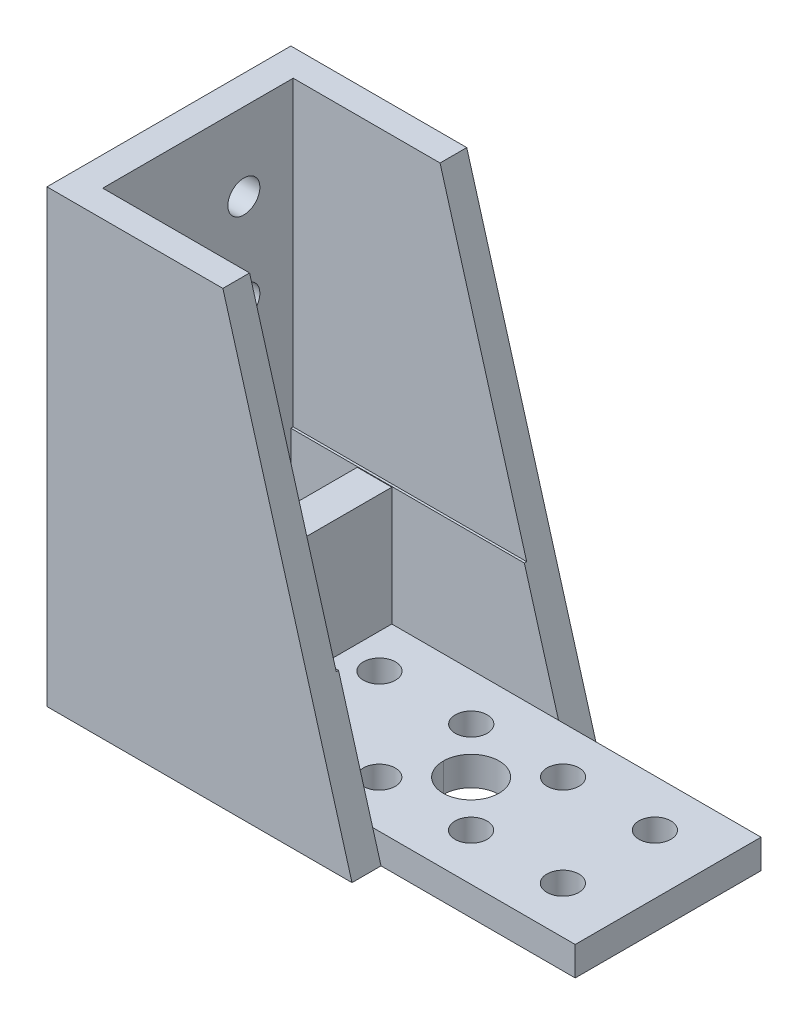
from build123d import *

# Parameters (mm, degrees)
BOSS_EXTRUDE1_DEPTH = 3.175
SKETCH2_W           = 13.335000012
SKETCH2_H           = 49.21889014
SKETCH2_R           = 1.75
BOSS_EXTRUDE2_DEPTH = 3.175
SKETCH3_W           = 46.34698368
SKETCH3_H           = 3.175
BOSS_EXTRUDE3_DEPTH = 10.160000012
SKETCH4_R           = 1.75
SKETCH4_R_2         = 3.05
CUT_EXTRUDE1_DEPTH  = 8.255
SKETCH5_W           = 3.773247043
SKETCH5_H           = 20.320000025
BOSS_EXTRUDE4_DEPTH = 12.954
SKETCH6_W           = 34.699402295
SKETCH6_H           = 0.254
CUT_EXTRUDE2_DEPTH  = 33.02


with BuildPart() as part:
    # Sketch1 → Boss-Extrude1 (new body)
    with BuildSketch(Plane.XY):
        Polygon((-22.541561274, 5.323288391), (-8.422284226, -43.895601749), (-38.601131181, -43.895601749), (-38.601131181, 5.323288391), align=None)
    extrude(amount=BOSS_EXTRUDE1_DEPTH)

    # Sketch2 → Boss-Extrude2 (add)
    with BuildSketch(Plane.ZY.offset(38.601131181)):
        with Locations((-3.492500006, -19.286156679)):
            Rectangle(SKETCH2_W, SKETCH2_H)
        with Locations(Location((-5.139541866, -3.179625598, 0), (0, 0, 270))):
            Circle(SKETCH2_R, mode=Mode.SUBTRACT)
        with Locations(Location((-5.139541866, -13.22054189, 0), (0, 0, 270))):
            Circle(SKETCH2_R, mode=Mode.SUBTRACT)
    extrude(amount=BOSS_EXTRUDE2_DEPTH)

    # Sketch3 → Boss-Extrude3 (add)
    with BuildSketch(Plane(origin=(0, 0, 0), x_dir=(-1, 0, 0), z_dir=(0, 0, -1))):
        with Locations((10.363026284, -42.308101749)):
            Rectangle(SKETCH3_W, SKETCH3_H)
    extrude(amount=BOSS_EXTRUDE3_DEPTH)

    # Sketch4 → Cut-Extrude1 (cut)
    with BuildSketch(Plane(origin=(0, -40.720601749, 0), x_dir=(1, 0, 0), z_dir=(0, 1, 0))):
        with Locations(Location((-3.706673055, 5.129541844, 0), (0, 0, 270))):
            Circle(SKETCH4_R)
        with Locations(Location((-23.788505641, 5.129541844, 0), (0, 0, 270))):
            Circle(SKETCH4_R)
        with Locations((6.334243237, 15.170458137)):
            Circle(SKETCH4_R)
        with Locations((-8.727131202, 10.149999991)):
            Circle(SKETCH4_R_2)
        with Locations(Location((6.334243237, 5.129541844, 0), (0, 0, 270))):
            Circle(SKETCH4_R)
        with Locations(Location((-13.747589348, 5.129541844, 0), (0, 0, 270))):
            Circle(SKETCH4_R)
        with Locations((-23.788505641, 15.170458137)):
            Circle(SKETCH4_R)
        with Locations((-3.706673055, 15.170458137)):
            Circle(SKETCH4_R)
        with Locations((-13.747589348, 15.170458137)):
            Circle(SKETCH4_R)
    extrude(amount=-CUT_EXTRUDE1_DEPTH, mode=Mode.SUBTRACT)

    # Mirror3: part across plane


with BuildPart() as part_1:
    add(part.part)
    add(part.part.mirror(Plane(origin=(-41.776131181, 5.323288391, -10.160000012), x_dir=(1, 0, 0), z_dir=(0, 0, 1))))

    # Sketch5 → Boss-Extrude4 (add)
    with BuildSketch(Plane(origin=(0, -40.720601749, 0), x_dir=(1, 0, 0), z_dir=(0, 1, 0))):
        with Locations((-29.452107965, 10.160000013)):
            Rectangle(SKETCH5_W, SKETCH5_H)
    extrude(amount=BOSS_EXTRUDE4_DEPTH)

    # Sketch6 → Cut-Extrude2 (cut)
    with BuildSketch(Plane(origin=(0, 5.323288391, 0), x_dir=(1, 0, 0), z_dir=(0, 1, 0))):
        with Locations((-21.251430034, 20.447000025)):
            Rectangle(SKETCH6_W, SKETCH6_H)
        with Locations((-21.251430034, -0.127)):
            Rectangle(SKETCH6_W, SKETCH6_H)
    extrude(amount=-CUT_EXTRUDE2_DEPTH, mode=Mode.SUBTRACT)


solid = part_1.part
